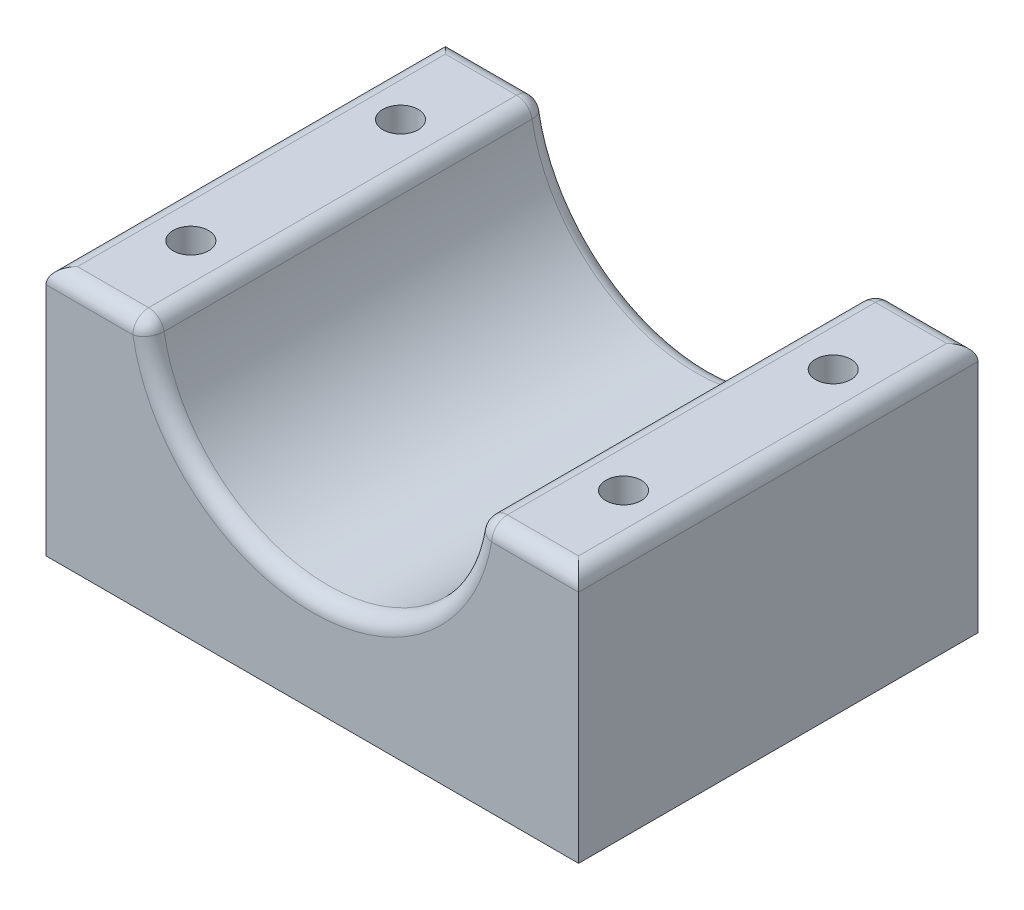
from build123d import *

# Parameters (mm, degrees)
SKETCH1_W            = 101.6
SKETCH1_H            = 47.8
BOSS_EXTRUDE1_DEPTH  = 76.2
SKETCH2_R            = 31.75
CUT_EXTRUDE1_DEPTH   = 95.648243512
FILLET1_R            = 3
LPATTERN1_COUNT      = 2
LPATTERN1_PITCH      = 82.55
LPATTERN1_COUNT_DIR2 = 2
LPATTERN1_PITCH_DIR2 = 40


with BuildPart() as part:
    # Sketch1 → Boss-Extrude1 (new body)
    with BuildSketch(Plane.XY):
        Rectangle(SKETCH1_W, SKETCH1_H)
    extrude(amount=BOSS_EXTRUDE1_DEPTH)

    # Sketch2 → Cut-Extrude1 (cut, through all)
    with BuildSketch(Plane.XY.offset(76.2)):
        with Locations((0, 26.9)):
            Circle(SKETCH2_R)
    extrude(amount=-CUT_EXTRUDE1_DEPTH, mode=Mode.SUBTRACT)

    # Fillet1
    fillet1_edges = [part.edges().sort_by_distance(p)[0] for p in [
        (-41.203974975, 23.9, 0),
        (-41.203974975, 23.9, 76.2),
        (0, -4.85, 76.2),
        (0, -4.85, 0),
        (31.607949949, 23.9, 38.1),
        (-31.607949949, 23.9, 38.1),
        (41.203974975, 23.9, 0),
        (-50.8, 23.9, 38.1),
        (50.8, 23.9, 38.1),
        (41.203974975, 23.9, 76.2),
    ]]
    fillet(fillet1_edges, radius=FILLET1_R)

    # Sketch4 → CBORE for 1/4 Binding Head Machine Screw1 (revolve, cut)
    with BuildSketch(Plane(origin=(-41.27, -23.9, 58.1), x_dir=(0, 0, -1), z_dir=(1, 0, 0))):
        Polygon((0, 0), (0, 47.8), (3.3782, 47.8), (3.3782, 4.191), (7.14375, 4.191), (7.14375, 0.532828266), (7.77875, 0), align=None)
    cbore_for_1_4_binding_head_machine_screw = revolve(axis=Axis((-41.27, -30.25, 58.1), (0, 1, 0)), mode=Mode.SUBTRACT)

    # LPattern1: CBORE for 1_4 Binding Head Machine Screw 2 × 2
    with Locations(*[(i * LPATTERN1_PITCH, 0, -j * LPATTERN1_PITCH_DIR2) for i in range(LPATTERN1_COUNT) for j in range(LPATTERN1_COUNT_DIR2) if (i, j) != (0, 0)]):
        add(cbore_for_1_4_binding_head_machine_screw, mode=Mode.SUBTRACT)


solid = part.part
